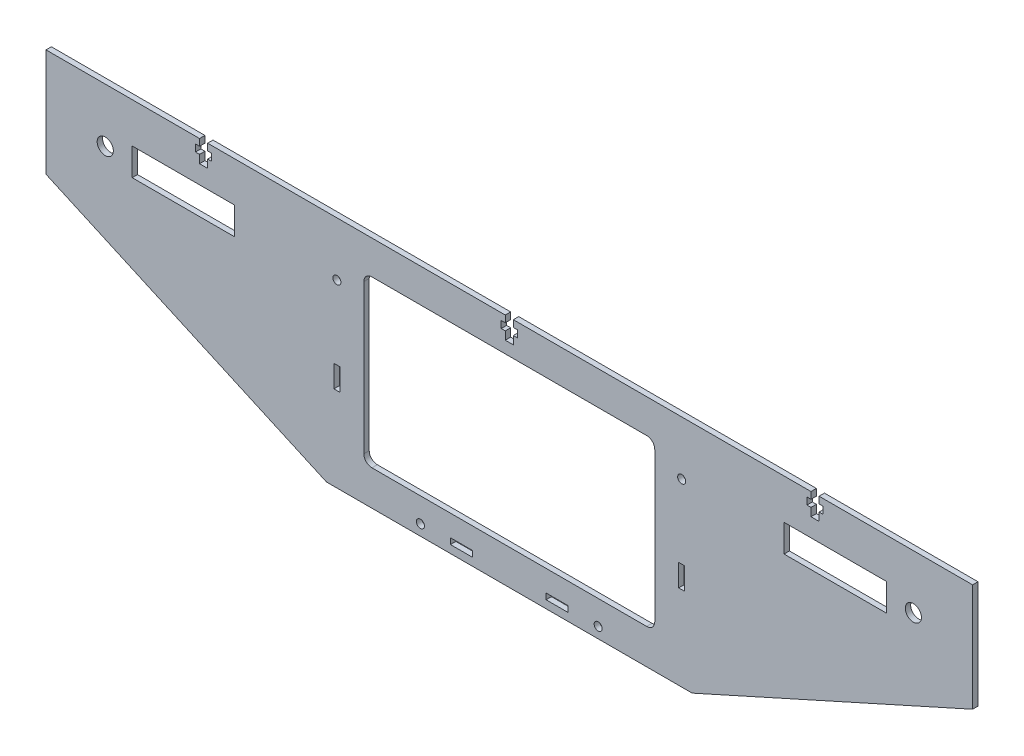
from build123d import *

# Parameters (mm, degrees)
SKETCH_1_R      = 1.5
SKETCH_1_W      = 8.2
SKETCH_1_H      = 2.2
SKETCH_1_W_2    = 2.2
SKETCH_1_H_2    = 8.2
SKETCH_1_R_2    = 3
EXTRUDE_1_DEPTH = 2


with BuildPart() as part:
    # 草图1 → 凸台-拉伸1 (new body)
    with BuildSketch(Plane.XY):
        Polygon((-68.061769393, -13.095981945), (-52.184883937, -13.095981945), (-18.934883937, -13.095981945), (18.565116063, -13.095981945), (67.695116063, -13.095981945), (171.815116063, 33.779018055), (171.815116063, 73.779018055), (114.815116063, 73.779018055), (114.815116063, 71.279018055), (116.315116063, 71.279018055), (116.315116063, 68.679018055), (114.815116063, 68.679018055), (114.815116063, 65.679018055), (111.815116063, 65.679018055), (111.815116063, 68.679018055), (110.315116063, 68.679018055), (110.315116063, 71.279018055), (111.815116063, 71.279018055), (111.815116063, 73.779018055), (1.315116063, 73.779018055), (1.315116063, 71.279018055), (2.815116063, 71.279018055), (2.815116063, 68.679018055), (1.315116063, 68.679018055), (1.315116063, 65.679018055), (-1.684883937, 65.679018055), (-1.684883937, 68.679018055), (-3.184883937, 68.679018055), (-3.184883937, 71.279018055), (-1.684883937, 71.279018055), (-1.684883937, 73.779018055), (-68.061769393, 73.779018055), (-112.184883937, 73.779018055), (-112.184883937, 71.279018055), (-110.684883937, 71.279018055), (-110.684883937, 68.679018055), (-112.184883937, 68.679018055), (-112.184883937, 65.679018055), (-115.184883937, 65.679018055), (-115.184883937, 68.679018055), (-116.684883937, 68.679018055), (-116.684883937, 71.279018055), (-115.184883937, 71.279018055), (-115.184883937, 73.779018055), (-172.184883937, 73.779018055), (-172.184883937, 33.779018055), align=None)
        with Locations((-33.184883937, -9.095981945)):
            Circle(SKETCH_1_R, mode=Mode.SUBTRACT)
        with Locations((-17.934883937, -9.095981946)):
            Rectangle(SKETCH_1_W, SKETCH_1_H, mode=Mode.SUBTRACT)
        with Locations((-64.184883937, 22.341518055)):
            Rectangle(SKETCH_1_W_2, SKETCH_1_H_2, mode=Mode.SUBTRACT)
        with Locations((17.565116063, -9.095981946)):
            Rectangle(SKETCH_1_W, SKETCH_1_H, mode=Mode.SUBTRACT)
        with Locations((32.815116063, -9.095981945)):
            Circle(SKETCH_1_R, mode=Mode.SUBTRACT)
        with Locations((63.815116063, 22.341518055)):
            Rectangle(SKETCH_1_W_2, SKETCH_1_H_2, mode=Mode.SUBTRACT)
        with BuildLine():
            ThreePointArc((50.815116063, 61.279018055), (52.936436406, 60.400338398), (53.815116063, 58.279018055))
            Line((53.815116063, 58.279018055), (53.815116063, 2.904018055))
            ThreePointArc((53.815116063, 2.904018055), (52.936436406, 0.782697711), (50.815116063, -0.095981945))
            Line((50.815116063, -0.095981945), (-51.184883937, -0.095981945))
            ThreePointArc((-51.184883937, -0.095981945), (-53.306204281, 0.782697711), (-54.184883937, 2.904018055))
            Line((-54.184883937, 2.904018055), (-54.184883937, 58.279018055))
            ThreePointArc((-54.184883937, 58.279018055), (-53.306204281, 60.400338398), (-51.184883937, 61.279018055))
            Line((-51.184883937, 61.279018055), (50.815116063, 61.279018055))
        make_face(mode=Mode.SUBTRACT)
        with Locations((-150.184883937, 53.779018055)):
            Circle(SKETCH_1_R_2, mode=Mode.SUBTRACT)
        Polygon((-140.184883937, 58.879018055), (-125.184883937, 58.879018055), (-102.184883937, 58.879018055), (-102.184883937, 48.679018055), (-125.184883937, 48.679018055), (-140.184883937, 48.679018055), align=None, mode=Mode.SUBTRACT)
        with Locations((-64.184883937, 53.779018055)):
            Circle(SKETCH_1_R, mode=Mode.SUBTRACT)
        with Locations((63.815116063, 53.779018055)):
            Circle(SKETCH_1_R, mode=Mode.SUBTRACT)
        Polygon((139.815116063, 48.679018055), (124.815116063, 48.679018055), (101.815116063, 48.679018055), (101.815116063, 58.879018055), (124.815116063, 58.879018055), (139.815116063, 58.879018055), align=None, mode=Mode.SUBTRACT)
        with Locations((149.815116063, 53.779018055)):
            Circle(SKETCH_1_R_2, mode=Mode.SUBTRACT)
    extrude(amount=EXTRUDE_1_DEPTH)


solid = part.part
